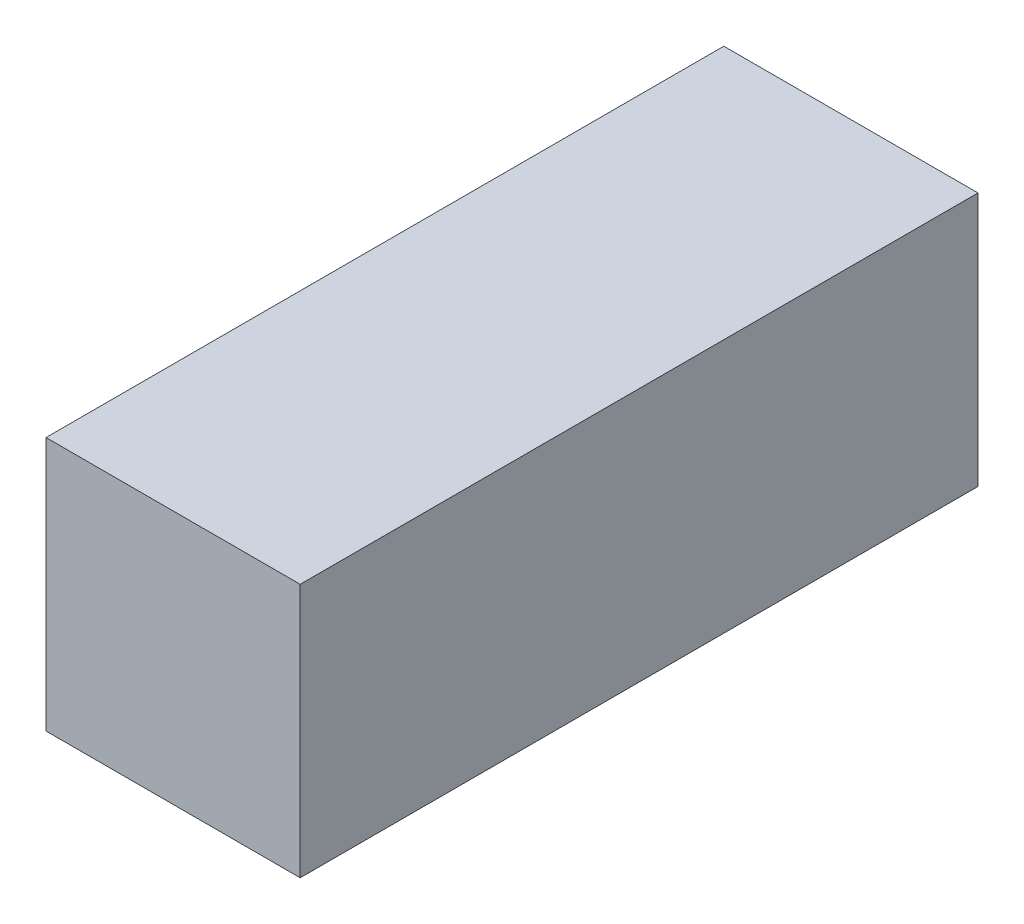
from build123d import *

# Parameters (mm, degrees)
SKETCH1_W           = 15
SKETCH1_H           = 15
BOSS_EXTRUDE1_DEPTH = 20
SKETCH2_R           = 5
CUT_EXTRUDE1_DEPTH  = 17.5


with BuildPart() as part:
    # Sketch1 → Boss-Extrude1 (new, symmetric)
    with BuildSketch(Plane.XY):
        Rectangle(SKETCH1_W, SKETCH1_H)
    extrude(amount=BOSS_EXTRUDE1_DEPTH, both=True)

    # Sketch2 → Cut-Extrude1 (cut, symmetric)
    with BuildSketch(Plane.XY):
        Circle(SKETCH2_R)
    extrude(amount=CUT_EXTRUDE1_DEPTH, both=True, mode=Mode.SUBTRACT)


solid = part.part
